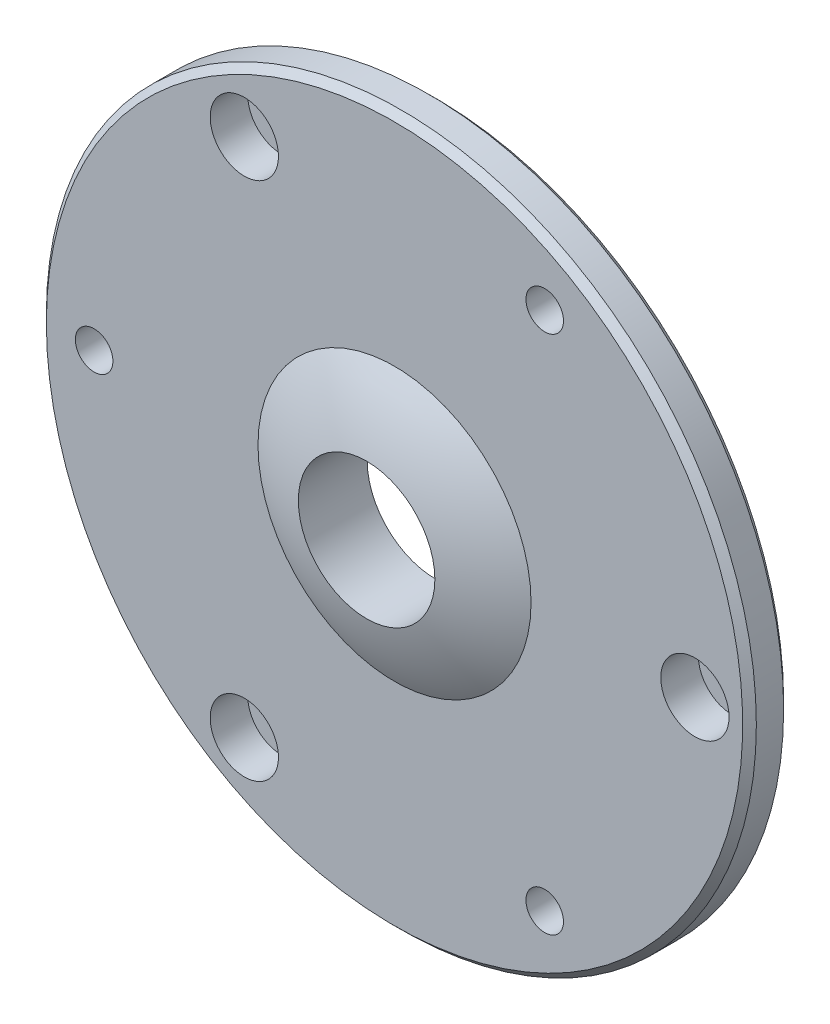
from build123d import *

# Parameters (mm, degrees)
SK_H0_R            = 2.75
CUT_H0_DEPTH       = 75.227920828
SK_H1_R            = 2.75
CUT_H1_DEPTH       = 75.227920828
SK_H2_R            = 2.75
CUT_H2_DEPTH       = 75.227920828
SK_H60_R           = 2.75
CUT_H60_DEPTH      = 75.227920828
SK_H180_R          = 2.75
CUT_H180_DEPTH     = 75.227920828
SK_H300_R          = 2.75
CUT_H300_DEPTH     = 75.227920828
SK_CB0_R           = 5
CUT_CB0_DEPTH      = 3.25
SK_CB1_R           = 5
CUT_CB1_DEPTH      = 3.25
SK_CB2_R           = 5
CUT_CB2_DEPTH      = 3.25
SK_GROOVE70_R      = 36.9
SK_GROOVE70_R_2    = 33.1
CUT_GROOVE70_DEPTH = 2.4
CHAMFER_C1_SIZE    = 1


with BuildPart() as part:
    # Sk_cover → Rev_cover (revolve)
    with BuildSketch(Plane(origin=(0, 0, 0), x_dir=(1, 0, 0), z_dir=(0, 1, 0)), mode=Mode.PRIVATE) as rev_cover_sk:
        with BuildLine():
            Line((10, 0), (52, 0))
            Line((52, 0), (52, -6))
            Line((52, -6), (20, -6))
            ThreePointArc((20, -6), (15.138679109, -8.383575327), (10, -10.088817))
            Line((10, -10.088817), (10, 0))
        make_face()
    revolve(rev_cover_sk.sketch.rotate(Axis((0, 0, 0), (0, 0, 1)), 180), axis=Axis((0, 0, 0), (0, 0, 1)))

    # Sk_h0 → Cut_h0 (cut, through all)
    with BuildSketch(Plane.XY):
        with Locations(Location((44, 0, 0), (0, 0, 180))):
            Circle(SK_H0_R)
    extrude(amount=CUT_H0_DEPTH, mode=Mode.SUBTRACT)

    # Sk_h1 → Cut_h1 (cut, through all)
    with BuildSketch(Plane.XY):
        with Locations(Location((-22, 38.105117767, 0), (0, 0, 180))):
            Circle(SK_H1_R)
    extrude(amount=CUT_H1_DEPTH, mode=Mode.SUBTRACT)

    # Sk_h2 → Cut_h2 (cut, through all)
    with BuildSketch(Plane.XY):
        with Locations(Location((-22, -38.105117767, 0), (0, 0, 180))):
            Circle(SK_H2_R)
    extrude(amount=CUT_H2_DEPTH, mode=Mode.SUBTRACT)

    # Sk_h60 → Cut_h60 (cut, through all)
    with BuildSketch(Plane.XY):
        with Locations(Location((22, 38.105117767, 0), (0, 0, 180))):
            Circle(SK_H60_R)
    extrude(amount=CUT_H60_DEPTH, mode=Mode.SUBTRACT)

    # Sk_h180 → Cut_h180 (cut, through all)
    with BuildSketch(Plane.XY):
        with Locations(Location((-44, 0, 0), (0, 0, 180))):
            Circle(SK_H180_R)
    extrude(amount=CUT_H180_DEPTH, mode=Mode.SUBTRACT)

    # Sk_h300 → Cut_h300 (cut, through all)
    with BuildSketch(Plane.XY):
        with Locations(Location((22, -38.105117767, 0), (0, 0, 180))):
            Circle(SK_H300_R)
    extrude(amount=CUT_H300_DEPTH, mode=Mode.SUBTRACT)

    # Sk_cb0 → Cut_cb0 (cut, symmetric)
    with BuildSketch(Plane.XY.offset(3.75)):
        with Locations((44, 0)):
            Circle(SK_CB0_R)
    extrude(amount=CUT_CB0_DEPTH, both=True, mode=Mode.SUBTRACT)

    # Sk_cb1 → Cut_cb1 (cut, symmetric)
    with BuildSketch(Plane.XY.offset(3.75)):
        with Locations((-22, 38.105117767)):
            Circle(SK_CB1_R)
    extrude(amount=CUT_CB1_DEPTH, both=True, mode=Mode.SUBTRACT)

    # Sk_cb2 → Cut_cb2 (cut, symmetric)
    with BuildSketch(Plane.XY.offset(3.75)):
        with Locations((-22, -38.105117767)):
            Circle(SK_CB2_R)
    extrude(amount=CUT_CB2_DEPTH, both=True, mode=Mode.SUBTRACT)

    # Sk_groove70 → Cut_groove70 (cut)
    with BuildSketch(Plane.XY):
        Circle(SK_GROOVE70_R)
        Circle(SK_GROOVE70_R_2, mode=Mode.SUBTRACT)
    extrude(amount=CUT_GROOVE70_DEPTH, mode=Mode.SUBTRACT)

    # Chamfer_C1
    chamfer_c1_edges = [part.edges().sort_by_distance(p)[0] for p in [
        (52, 0, 6),
        (52, 0, 0),
    ]]
    chamfer(chamfer_c1_edges, length=CHAMFER_C1_SIZE)


solid = part.part
